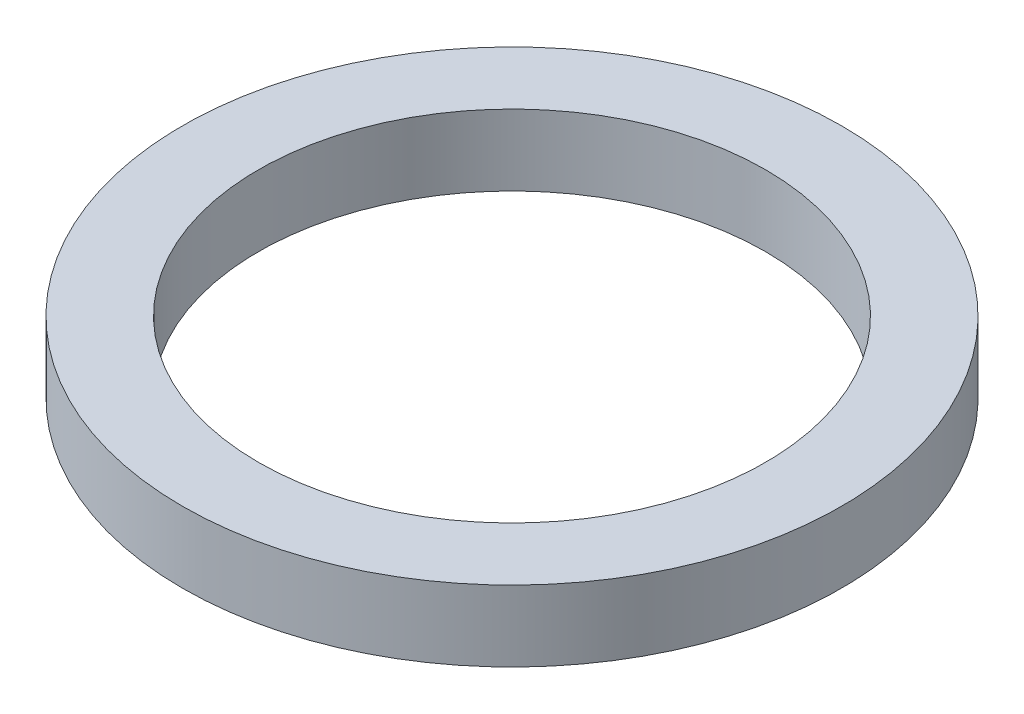
from build123d import *

# Parameters (mm, degrees)
CROQUIS1_R              = 32.5
CROQUIS1_R_2            = 25
SALIENTE_EXTRUIR1_DEPTH = 7


with BuildPart() as part:
    # Croquis1 → Saliente-Extruir1 (new body)
    with BuildSketch(Plane(origin=(0, 0, 0), x_dir=(1, 0, 0), z_dir=(0, 1, 0))):
        with Locations(Location((0, 0, 0), (0, 0, 270))):
            Circle(CROQUIS1_R)
        with Locations(Location((0, 0, 0), (0, 0, 270))):
            Circle(CROQUIS1_R_2, mode=Mode.SUBTRACT)
    extrude(amount=SALIENTE_EXTRUIR1_DEPTH)


solid = part.part
